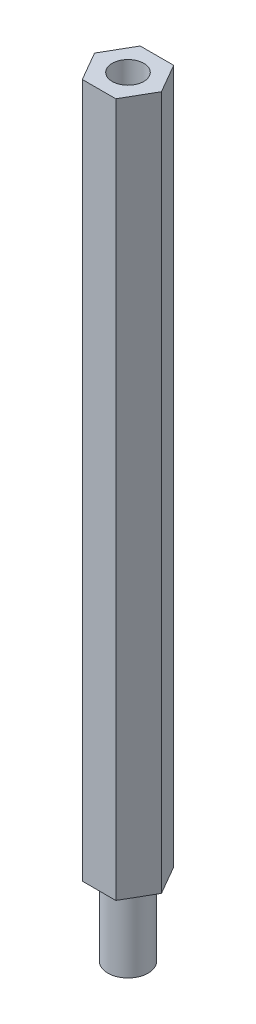
from build123d import *

# Parameters (mm, degrees)
EXTRUDE_1_DEPTH     = 55
SKETCH_6_R          = 1.6
EXTRUDE_2_DEPTH     = 6
SKETCH_7_R          = 1.25
CUT_EXTRUDE_1_DEPTH = 5


with BuildPart() as part:
    # 草图4 → 凸台-拉伸1 (new body)
    with BuildSketch(Plane(origin=(0, 0, 0), x_dir=(1, 0, 0), z_dir=(0, 1, 0))):
        Polygon((1.325, -2.29496732), (2.65, 0), (1.325, 2.29496732), (-1.325, 2.29496732), (-2.65, 0), (-1.325, -2.29496732), align=None)
    extrude(amount=EXTRUDE_1_DEPTH)

    # 草图6 → 凸台-拉伸2 (add)
    with BuildSketch(Plane(origin=(0, 0, 0), x_dir=(-1, 0, 0), z_dir=(0, -1, 0))):
        with Locations(Location((0, 0, 0), (0, 0, 270))):
            Circle(SKETCH_6_R)
    extrude(amount=EXTRUDE_2_DEPTH)

    # 草图7 → 切除-拉伸1 (cut)
    with BuildSketch(Plane(origin=(0, 55, 0), x_dir=(1, 0, 0), z_dir=(0, 1, 0))):
        with Locations(Location((0, 0, 0), (0, 0, 270))):
            Circle(SKETCH_7_R)
    extrude(amount=-CUT_EXTRUDE_1_DEPTH, mode=Mode.SUBTRACT)


solid = part.part
